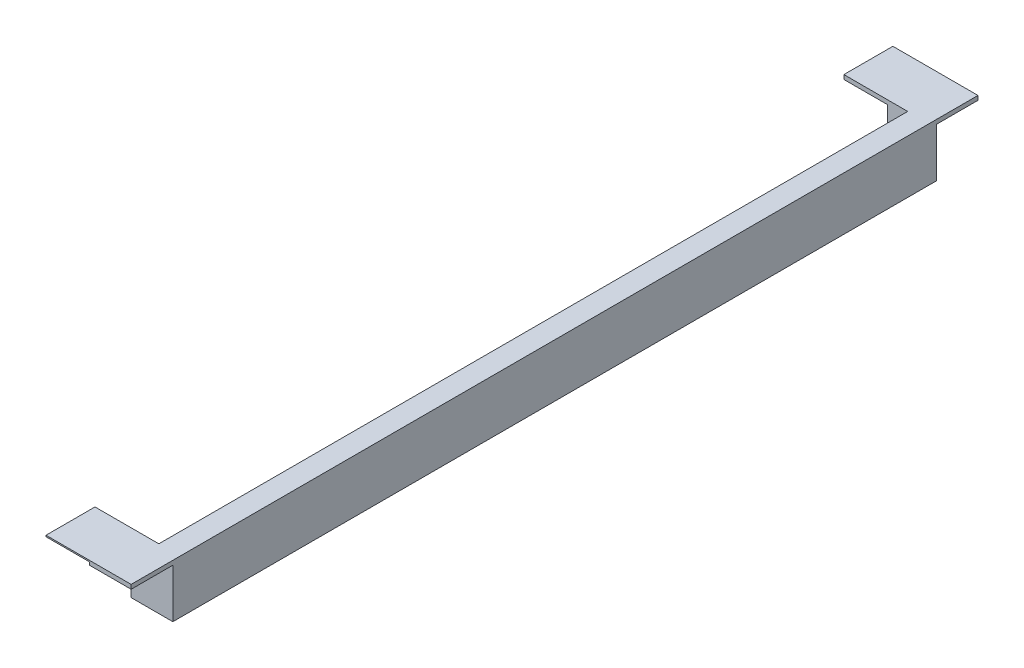
from build123d import *

# Parameters (mm, degrees)
SKETCH_2_W      = 98
SKETCH_2_H      = 98
EXTRUDE_1_DEPTH = 10
SKETCH_3_W      = 98
SKETCH_3_H      = 125
EXTRUDE_2_DEPTH = 10
SKETCH_4_W      = 98
SKETCH_4_H      = 62.5
EXTRUDE_3_DEPTH = 886.75
SKETCH_5_W      = 98
SKETCH_5_H      = 62.5
EXTRUDE_4_DEPTH = 7.1
SKETCH_6_W      = 98
SKETCH_6_H      = 62.5
EXTRUDE_5_DEPTH = 7.1
SKETCH_9_W      = 115.1
SKETCH_9_H      = 10
SKETCH_9_H_2    = 3.2
EXTRUDE_6_DEPTH = 102
SKETCH_11_W     = 50
SKETCH_11_H     = 1759.3
EXTRUDE_7_DEPTH = 62.5


with BuildPart() as part:
    # 草图2 → 凸台-拉伸1 (new body)
    with BuildSketch(Plane(origin=(0, 0, 0), x_dir=(1, 0, 0), z_dir=(0, 1, 0))):
        with Locations((34.507061985, 30.744472309)):
            Rectangle(SKETCH_2_W, SKETCH_2_H)
    extrude(amount=EXTRUDE_1_DEPTH)

    # 草图3 → 凸台-拉伸2 (add)
    with BuildSketch(Plane.XY.offset(18.255527691)):
        with Locations((34.507061985, -52.5)):
            Rectangle(SKETCH_3_W, SKETCH_3_H)
    extrude(amount=EXTRUDE_2_DEPTH)

    # 草图4 → 凸台-拉伸3 (add)
    with BuildSketch(Plane.XY.offset(28.255527691)):
        with Locations((34.507061985, -83.75)):
            Rectangle(SKETCH_4_W, SKETCH_4_H)
    extrude(amount=EXTRUDE_3_DEPTH)

    # 镜向4: part across plane


with BuildPart() as part_1:
    add(part.part)
    add(part.part.mirror(Plane.XY.offset(915.005527691)))

    # 草图5 → 凸台-拉伸4 (add)
    with BuildSketch(Plane.XY.offset(28.255527691)):
        with Locations((34.507061985, -21.25)):
            Rectangle(SKETCH_5_W, SKETCH_5_H)
    extrude(amount=EXTRUDE_4_DEPTH)

    # 草图6 → 凸台-拉伸5 (add)
    with BuildSketch(Plane(origin=(0, 0, 1801.755527691), x_dir=(-1, 0, 0), z_dir=(0, 0, -1))):
        with Locations((-34.507061985, -21.25)):
            Rectangle(SKETCH_6_W, SKETCH_6_H)
    extrude(amount=EXTRUDE_5_DEPTH)

    # 草图9 → 凸台-拉伸6 (add)
    with BuildSketch(Plane.ZY.offset(14.492938015)):
        with Locations((-22.194472309, 5)):
            Rectangle(SKETCH_9_W, SKETCH_9_H)
        with Locations((1852.205527691, 8.4)):
            Rectangle(SKETCH_9_W, SKETCH_9_H_2)
    extrude(amount=EXTRUDE_6_DEPTH)

    # 草图11 → 凸台-拉伸7 (add)
    with BuildSketch(Plane(origin=(0, -52.5, 0), x_dir=(1, 0, 0), z_dir=(0, 1, 0))):
        with Locations((58.507061985, -915.005527691)):
            Rectangle(SKETCH_11_W, SKETCH_11_H)
    extrude(amount=EXTRUDE_7_DEPTH)


solid = part_1.part
